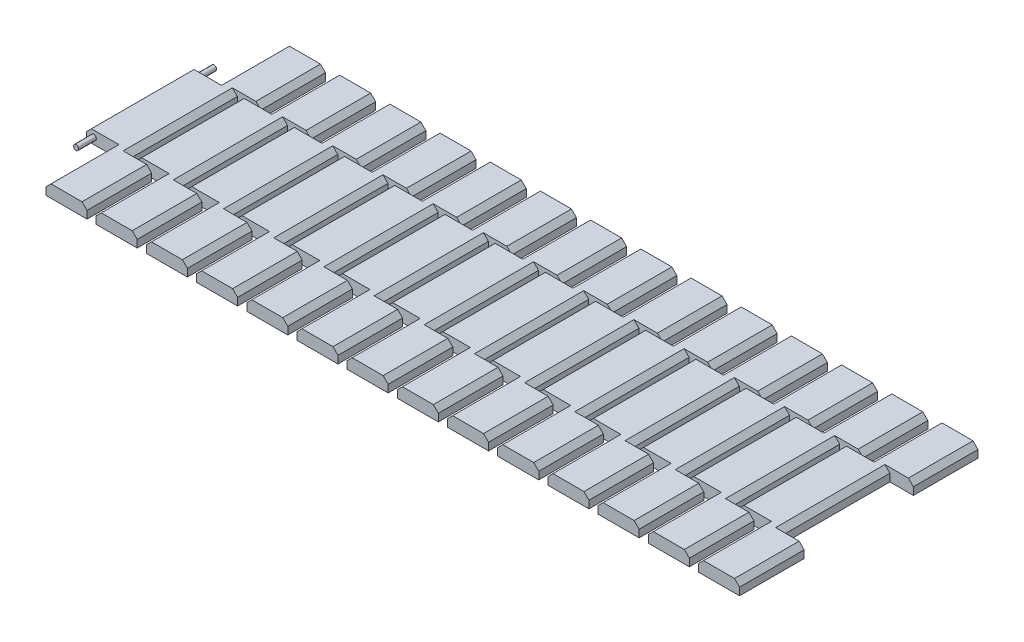
from build123d import *

# Parameters (mm, degrees)
BOSS_EXTRUDE1_DEPTH = 5
CHAMFER1_SIZE       = 2
BOSS_EXTRUDE2_START = -20.437037
SKETCH3_R           = 1.021691407
BOSS_EXTRUDE2_DEPTH = 27.5
LPATTERN5_COUNT     = 14
LPATTERN5_PITCH     = 20


with BuildPart() as part:
    # Sketch1 → Boss-Extrude1 (new body)
    with BuildSketch(Plane(origin=(0, 0, 0), x_dir=(1, 0, 0), z_dir=(0, 1, 0))):
        Polygon((8.173313244, -21.765188952), (8.173313244, -47.509638464), (-8.173313244, -47.509638464), (-8.173313244, -20.437036541), (-19.147216023, -20.437036541), (-19.147216023, 20.437036541), (-8.173313244, 20.437036541), (-8.173313244, 47.509638464), (8.173313244, 47.509638464), (8.173313244, 21.765188952), (-1.185270067, 21.765188952), (-1.185270067, -21.765188952), align=None)
    extrude(amount=BOSS_EXTRUDE1_DEPTH)

    # Chamfer1
    chamfer1_edges = [part.edges().sort_by_distance(p)[0] for p in [
        (-1.185270067, 5, 0),
        (8.173313244, 5, -34.637413708),
        (-8.173313244, 5, -33.973337503),
        (-19.147216023, 5, 0),
        (-8.173313244, 5, 33.973337503),
        (8.173313244, 5, 34.637413708),
    ]]
    chamfer(chamfer1_edges, length=CHAMFER1_SIZE)

    # Sketch3 → Boss-Extrude2 (add, symmetric)
    with BuildSketch(Plane.XY.offset(20.437036541).offset(BOSS_EXTRUDE2_START)):
        with Locations(Location((-16.214711164, 2.5, 0), (0, 0, 180))):
            Circle(SKETCH3_R)
    extrude(amount=BOSS_EXTRUDE2_DEPTH, both=True)


with BuildPart() as lpattern5_1:
    # LPattern5: pattern copy
    add(part.part.moved(Location(Vector(-1, 0, 0) * (1 * LPATTERN5_PITCH))))


with BuildPart() as lpattern5_2:
    # LPattern5: pattern copy
    add(part.part.moved(Location(Vector(-1, 0, 0) * (2 * LPATTERN5_PITCH))))


with BuildPart() as lpattern5_3:
    # LPattern5: pattern copy
    add(part.part.moved(Location(Vector(-1, 0, 0) * (3 * LPATTERN5_PITCH))))


with BuildPart() as lpattern5_4:
    # LPattern5: pattern copy
    add(part.part.moved(Location(Vector(-1, 0, 0) * (4 * LPATTERN5_PITCH))))


with BuildPart() as lpattern5_5:
    # LPattern5: pattern copy
    add(part.part.moved(Location(Vector(-1, 0, 0) * (5 * LPATTERN5_PITCH))))


with BuildPart() as lpattern5_6:
    # LPattern5: pattern copy
    add(part.part.moved(Location(Vector(-1, 0, 0) * (6 * LPATTERN5_PITCH))))


with BuildPart() as lpattern5_7:
    # LPattern5: pattern copy
    add(part.part.moved(Location(Vector(-1, 0, 0) * (7 * LPATTERN5_PITCH))))


with BuildPart() as lpattern5_8:
    # LPattern5: pattern copy
    add(part.part.moved(Location(Vector(-1, 0, 0) * (8 * LPATTERN5_PITCH))))


with BuildPart() as lpattern5_9:
    # LPattern5: pattern copy
    add(part.part.moved(Location(Vector(-1, 0, 0) * (9 * LPATTERN5_PITCH))))


with BuildPart() as lpattern5_10:
    # LPattern5: pattern copy
    add(part.part.moved(Location(Vector(-1, 0, 0) * (10 * LPATTERN5_PITCH))))


with BuildPart() as lpattern5_11:
    # LPattern5: pattern copy
    add(part.part.moved(Location(Vector(-1, 0, 0) * (11 * LPATTERN5_PITCH))))


with BuildPart() as lpattern5_12:
    # LPattern5: pattern copy
    add(part.part.moved(Location(Vector(-1, 0, 0) * (12 * LPATTERN5_PITCH))))


with BuildPart() as lpattern5_13:
    # LPattern5: pattern copy
    add(part.part.moved(Location(Vector(-1, 0, 0) * (13 * LPATTERN5_PITCH))))


solid = Compound([part.part, lpattern5_1.part, lpattern5_2.part, lpattern5_3.part, lpattern5_4.part, lpattern5_5.part, lpattern5_6.part, lpattern5_7.part, lpattern5_8.part, lpattern5_9.part, lpattern5_10.part, lpattern5_11.part, lpattern5_12.part, lpattern5_13.part])
